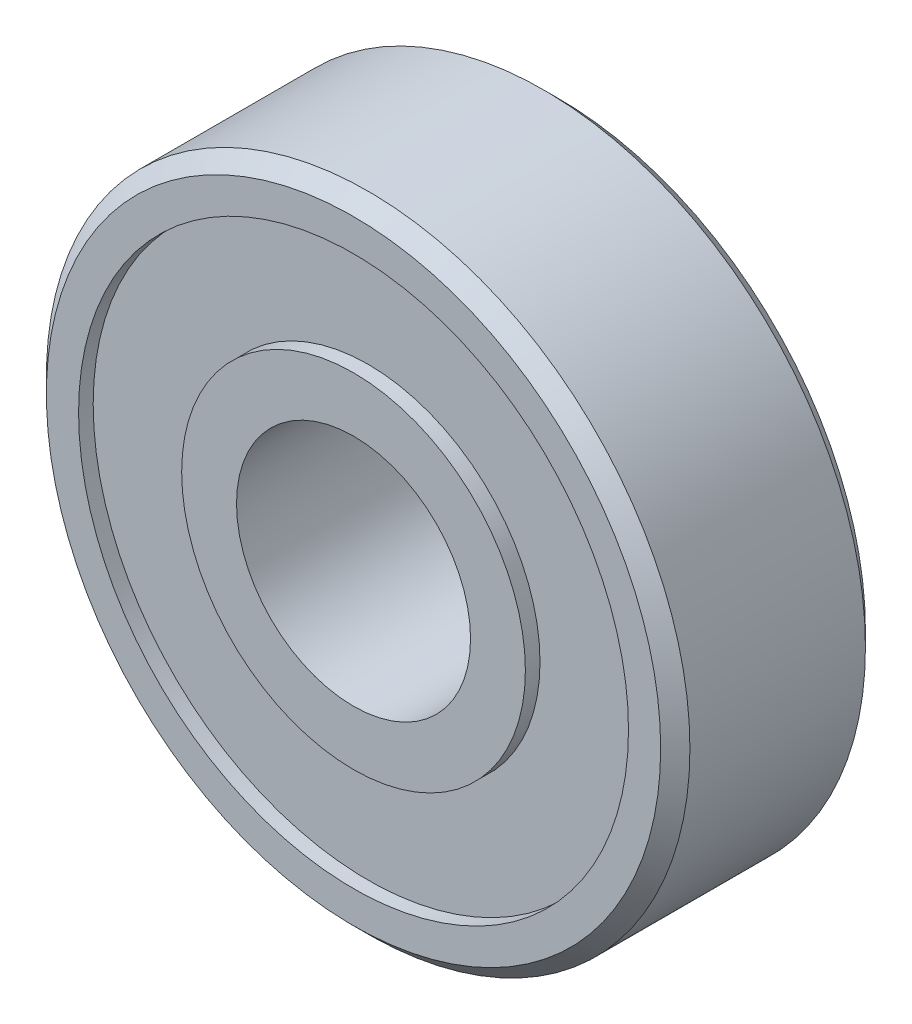
from build123d import *

# Parameters (mm, degrees)
SKETCH1_R           = 11
SKETCH1_R_2         = 4
BOSS_EXTRUDE1_DEPTH = 3.5
SKETCH2_R           = 9.4
SKETCH2_R_2         = 5.875
CUT_EXTRUDE1_DEPTH  = 0.5
CUT_EXTRUDE2_START  = -1
SKETCH3_R           = 9.4
SKETCH3_R_2         = 5.875
CUT_EXTRUDE2_DEPTH  = 1
CHAMFER1_SIZE       = 0.5


with BuildPart() as part:
    # Sketch1 → Boss-Extrude1 (new, symmetric)
    with BuildSketch(Plane.XY):
        Circle(SKETCH1_R)
        Circle(SKETCH1_R_2, mode=Mode.SUBTRACT)
    extrude(amount=BOSS_EXTRUDE1_DEPTH, both=True)

    # Sketch2 → Cut-Extrude1 (cut)
    with BuildSketch(Plane.XY.offset(3.5)):
        Circle(SKETCH2_R)
        Circle(SKETCH2_R_2, mode=Mode.SUBTRACT)
    extrude(amount=-CUT_EXTRUDE1_DEPTH, mode=Mode.SUBTRACT)

    # Sketch3 → Cut-Extrude2 (cut)
    with BuildSketch(Plane(origin=(0, 0, -3.5), x_dir=(-1, 0, 0), z_dir=(0, 0, -1)).offset(CUT_EXTRUDE2_START)):
        with Locations(Location((0, 0, 0), (0, 0, 180))):
            Circle(SKETCH3_R)
        with Locations(Location((0, 0, 0), (0, 0, 180))):
            Circle(SKETCH3_R_2, mode=Mode.SUBTRACT)
    extrude(amount=CUT_EXTRUDE2_DEPTH, mode=Mode.SUBTRACT)

    # Chamfer1
    chamfer1_edges = [part.edges().sort_by_distance(p)[0] for p in [
        (-11, 0, -3.5),
        (-11, 0, 3.5),
    ]]
    chamfer(chamfer1_edges, length=CHAMFER1_SIZE)


solid = part.part
